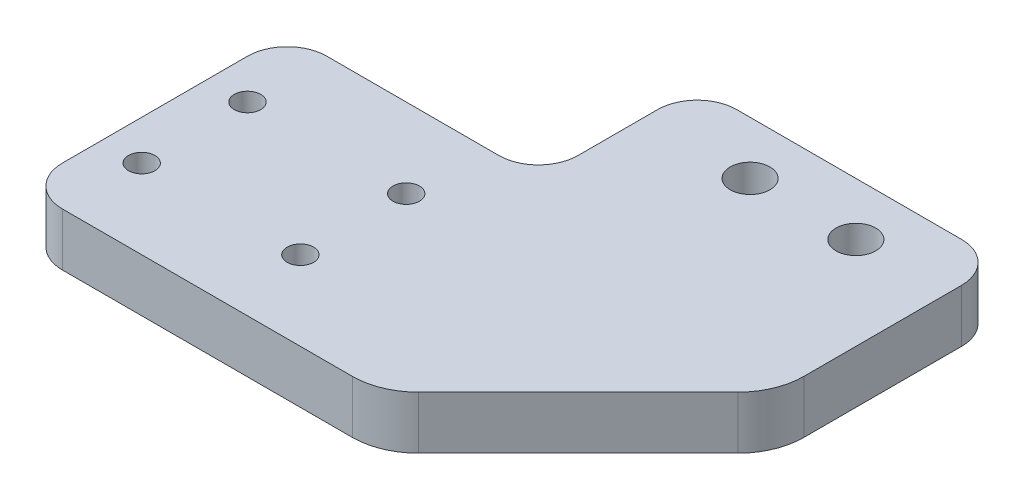
from build123d import *

# Parameters (mm, degrees)
SKETCH_1_W      = 23
SKETCH_1_H      = 20
SKETCH_1_H_2    = 12
SKETCH_1_R      = 1.5
SKETCH_1_W_2    = 19
SKETCH_1_R_2    = 1
EXTRUDE_1_DEPTH = 4
FILLET_1_R      = 3
CHAMFER_1_SIZE  = 15
FILLET_2_R      = 5


with BuildPart() as part:
    # 草图1 → 凸台-拉伸1 (new body)
    # profile 1 of 3: a face of its own
    with BuildSketch(Plane(origin=(0, 0, 0), x_dir=(1, 0, 0), z_dir=(0, 1, 0))):
        with Locations((51.5, 0)):
            Rectangle(SKETCH_1_W, SKETCH_1_H)
    # profile 2 of 3: a face of its own
    with BuildSketch(Plane(origin=(0, 0, 0), x_dir=(1, 0, 0), z_dir=(0, 1, 0))):
        with Locations((51.5, 16)):
            Rectangle(SKETCH_1_W, SKETCH_1_H_2)
        with Locations(Location((56, 18, 0), (0, 0, 270))):
            Circle(SKETCH_1_R, mode=Mode.SUBTRACT)
        with Locations(Location((48, 18, 0), (0, 0, 270))):
            Circle(SKETCH_1_R, mode=Mode.SUBTRACT)
    # profile 3 of 3: a face of its own
    with BuildSketch(Plane(origin=(0, 0, 0), x_dir=(1, 0, 0), z_dir=(0, 1, 0))):
        with Locations((30.5, 0)):
            Rectangle(SKETCH_1_W_2, SKETCH_1_H)
        with Locations(Location((24, -4, 0), (0, 0, 270))):
            Circle(SKETCH_1_R_2, mode=Mode.SUBTRACT)
        with Locations(Location((36, -4, 0), (0, 0, 270))):
            Circle(SKETCH_1_R_2, mode=Mode.SUBTRACT)
        with Locations(Location((24, 4, 0), (0, 0, 270))):
            Circle(SKETCH_1_R_2, mode=Mode.SUBTRACT)
        with Locations(Location((36, 4, 0), (0, 0, 270))):
            Circle(SKETCH_1_R_2, mode=Mode.SUBTRACT)
    extrude(amount=EXTRUDE_1_DEPTH)

    # 圆角1
    fillet_1_edges = [part.edges().sort_by_distance(p)[0] for p in [
        (21, 2, 10),
        (21, 2, -10),
        (40, 2, -10),
        (40, 2, -22),
        (63, 2, -22),
    ]]
    fillet(fillet_1_edges, radius=FILLET_1_R)

    # 倒角1
    chamfer_1_edges = [part.edges().sort_by_distance(p)[0] for p in [
        (63, 2, 10),
    ]]
    chamfer(chamfer_1_edges, length=CHAMFER_1_SIZE)

    # 圆角2
    fillet_2_edges = [part.edges().sort_by_distance(p)[0] for p in [
        (63, 2, -5),
        (48, 2, 10),
    ]]
    fillet(fillet_2_edges, radius=FILLET_2_R)


solid = part.part
